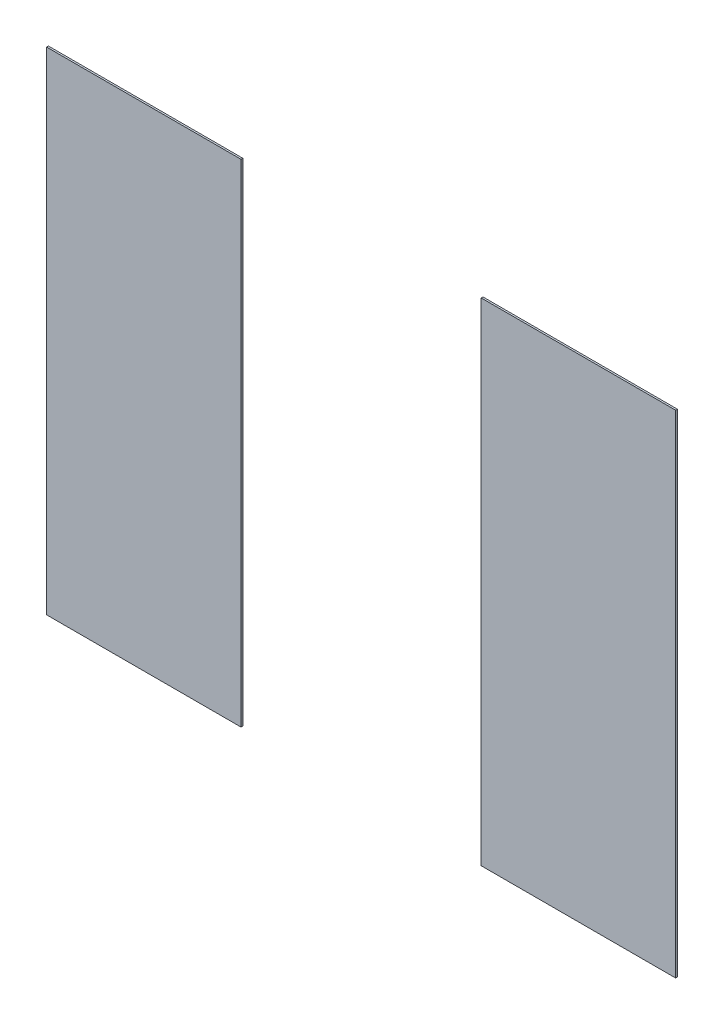
from build123d import *

# Parameters (mm, degrees)
SKETCH_1_W        = 2.159
SKETCH_1_H        = 5.461
EXTRUDE_1_DEPTH   = 0.02
EXTRUDE_1_2_DEPTH = 0.02


with BuildPart() as part:
    # 草图1 → 凸台-拉伸1 (new body)
    with BuildSketch(Plane.XY):
        with Locations((-2.413, 0)):
            Rectangle(SKETCH_1_W, SKETCH_1_H)
    extrude(amount=EXTRUDE_1_DEPTH)


with BuildPart() as body_2:
    # 草图1 → Extrude 1 2 (new body)
    with BuildSketch(Plane.XY):
        with Locations((2.413, 0)):
            Rectangle(SKETCH_1_W, SKETCH_1_H)
    extrude(amount=EXTRUDE_1_2_DEPTH)


solid = Compound([part.part, body_2.part])
